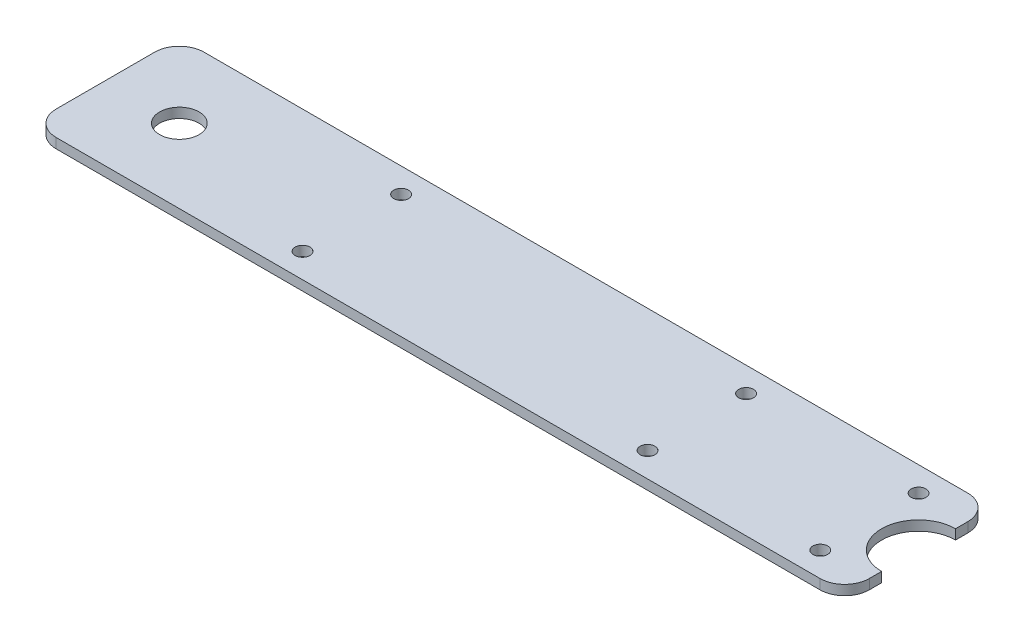
from build123d import *

# Parameters (mm, degrees)
SKETCH1_W           = 165
SKETCH1_H           = 30
BOSS_EXTRUDE1_DEPTH = 2
FILLET1_R           = 5
SKETCH3_R           = 4
CUT_EXTRUDE1_DEPTH  = 2
SKETCH4_R           = 7.5
CUT_EXTRUDE2_DEPTH  = 10
SKETCH5_R           = 1.5
CUT_EXTRUDE3_DEPTH  = 10
SKETCH6_R           = 1.5
CUT_EXTRUDE4_DEPTH  = 84.876397157


with BuildPart() as part:
    # Sketch1 → Boss-Extrude1 (new body)
    with BuildSketch(Plane(origin=(0, 0, 0), x_dir=(1, 0, 0), z_dir=(0, 1, 0))):
        Rectangle(SKETCH1_W, SKETCH1_H)
    extrude(amount=BOSS_EXTRUDE1_DEPTH)

    # Fillet1
    fillet1_edges = [part.edges().sort_by_distance(p)[0] for p in [
        (82.5, 1, 15),
        (-82.5, 1, 15),
        (-82.5, 1, -15),
        (82.5, 1, -15),
    ]]
    fillet(fillet1_edges, radius=FILLET1_R)

    # Sketch3 → Cut-Extrude1 (cut)
    with BuildSketch(Plane(origin=(0, 2, 0), x_dir=(1, 0, 0), z_dir=(0, 1, 0))):
        with Locations(Location((-67.5, 0, 0), (0, 0, 270))):
            Circle(SKETCH3_R)
    extrude(amount=-CUT_EXTRUDE1_DEPTH, mode=Mode.SUBTRACT)

    # Sketch4 → Cut-Extrude2 (cut)
    with BuildSketch(Plane(origin=(0, 2, 0), x_dir=(1, 0, 0), z_dir=(0, 1, 0))):
        with Locations((82.5, 0)):
            Circle(SKETCH4_R)
    extrude(amount=-CUT_EXTRUDE2_DEPTH, mode=Mode.SUBTRACT)

    # Sketch5 → Cut-Extrude3 (cut)
    with BuildSketch(Plane(origin=(0, 2, 0), x_dir=(1, 0, 0), z_dir=(0, 1, 0))):
        with Locations(Location((-32.5, 10, 0), (0, 0, 270))):
            Circle(SKETCH5_R)
        with Locations(Location((37.5, 10, 0), (0, 0, 270))):
            Circle(SKETCH5_R)
        with Locations(Location((-32.5, -10, 0), (0, 0, 270))):
            Circle(SKETCH5_R)
        with Locations(Location((37.5, -10, 0), (0, 0, 270))):
            Circle(SKETCH5_R)
    extrude(amount=-CUT_EXTRUDE3_DEPTH, mode=Mode.SUBTRACT)

    # Sketch6 → Cut-Extrude4 (cut, through all)
    with BuildSketch(Plane(origin=(0, 2, 0), x_dir=(1, 0, 0), z_dir=(0, 1, 0))):
        with Locations(Location((72.5, 10, 0), (0, 0, 270))):
            Circle(SKETCH6_R)
        with Locations(Location((72.555859106, -10, 0), (0, 0, 270))):
            Circle(SKETCH6_R)
    extrude(amount=-CUT_EXTRUDE4_DEPTH, mode=Mode.SUBTRACT)


solid = part.part
